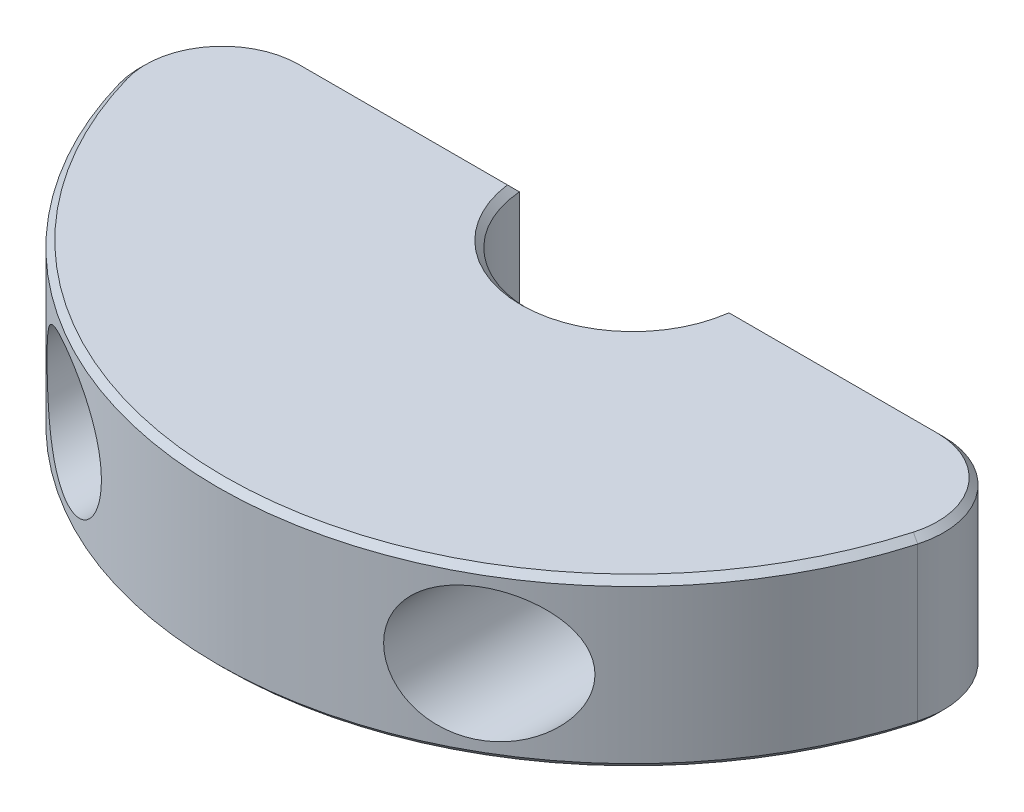
from build123d import *

# Parameters (mm, degrees)
BOSS_EXTRUDE1_DEPTH = 10
FILLET1_R           = 5
SKETCH2_R           = 1.5
CUT_EXTRUDE1_DEPTH  = 36.878807745
CUT_EXTRUDE2_START  = -10
SKETCH2_3_R         = 4
SKETCH2_3_R_2       = 1.5
CUT_EXTRUDE2_DEPTH  = 26.878807842
CHAMFER1_SIZE       = 0.381


with BuildPart() as part:
    # Sketch1 → Boss-Extrude1 (new body)
    with BuildSketch(Plane(origin=(0, 0, 0), x_dir=(1, 0, 0), z_dir=(0, 1, 0))):
        with BuildLine():
            Line((-6.330284354, -50.5), (-24.9949995, -50.5))
            ThreePointArc((-24.9949995, -50.5), (0, -75), (24.9949995, -50.5))
            Line((24.9949995, -50.5), (6.330284354, -50.5))
            ThreePointArc((6.330284354, -50.5), (0, -56.35), (-6.330284354, -50.5))
        make_face()
    extrude(amount=BOSS_EXTRUDE1_DEPTH)

    # Fillet1
    fillet1_edges = [part.edges().sort_by_distance(p)[0] for p in [
        (-24.9949995, 5, 50.5),
        (24.9949995, 5, 50.5),
    ]]
    fillet(fillet1_edges, radius=FILLET1_R)

    # Sketch2 → Cut-Extrude1 (cut, through all)
    with BuildSketch(Plane(origin=(0, 0, 50.5), x_dir=(-1, 0, 0), z_dir=(0, 0, -1))):
        with Locations((-12.5, 5)):
            Circle(SKETCH2_R)
        with Locations((12.5, 5)):
            Circle(SKETCH2_R)
    extrude(amount=-CUT_EXTRUDE1_DEPTH, mode=Mode.SUBTRACT)

    # Sketch2<3> → Cut-Extrude2 (cut, through all)
    # profile 1 of 2: a face of its own
    with BuildSketch(Plane(origin=(0, 0, 50.5), x_dir=(-1, 0, 0), z_dir=(0, 0, -1)).offset(CUT_EXTRUDE2_START)):
        with Locations((-12.5, 5)):
            Circle(SKETCH2_3_R)
        with Locations((-12.5, 5)):
            Circle(SKETCH2_3_R_2, mode=Mode.SUBTRACT)
    # profile 2 of 2: a face of its own
    with BuildSketch(Plane(origin=(0, 0, 50.5), x_dir=(-1, 0, 0), z_dir=(0, 0, -1)).offset(CUT_EXTRUDE2_START)):
        with Locations((12.5, 5)):
            Circle(SKETCH2_3_R)
        with Locations((12.5, 5)):
            Circle(SKETCH2_3_R_2, mode=Mode.SUBTRACT)
    extrude(amount=-CUT_EXTRUDE2_DEPTH, mode=Mode.SUBTRACT)

    # Chamfer1
    chamfer1_edges = [part.edges().sort_by_distance(p)[0] for p in [
        (-11, 5, 50.5),
        (-11, 5, 60.5),
        (14, 5, 50.5),
        (14, 5, 60.5),
        (0, 10, 56.35),
        (-12.779584438, 10, 50.5),
        (12.779584438, 10, 50.5),
        (-23.221064379, 10, 52.489601355),
        (23.221064379, 10, 52.489601355),
        (0, 10, 75),
        (0, 0, 56.35),
        (-12.779584438, 0, 50.5),
        (12.779584438, 0, 50.5),
        (-23.221064379, 0, 52.489601355),
        (23.221064379, 0, 52.489601355),
        (0, 0, 75),
    ]]
    chamfer(chamfer1_edges, length=CHAMFER1_SIZE)


solid = part.part
